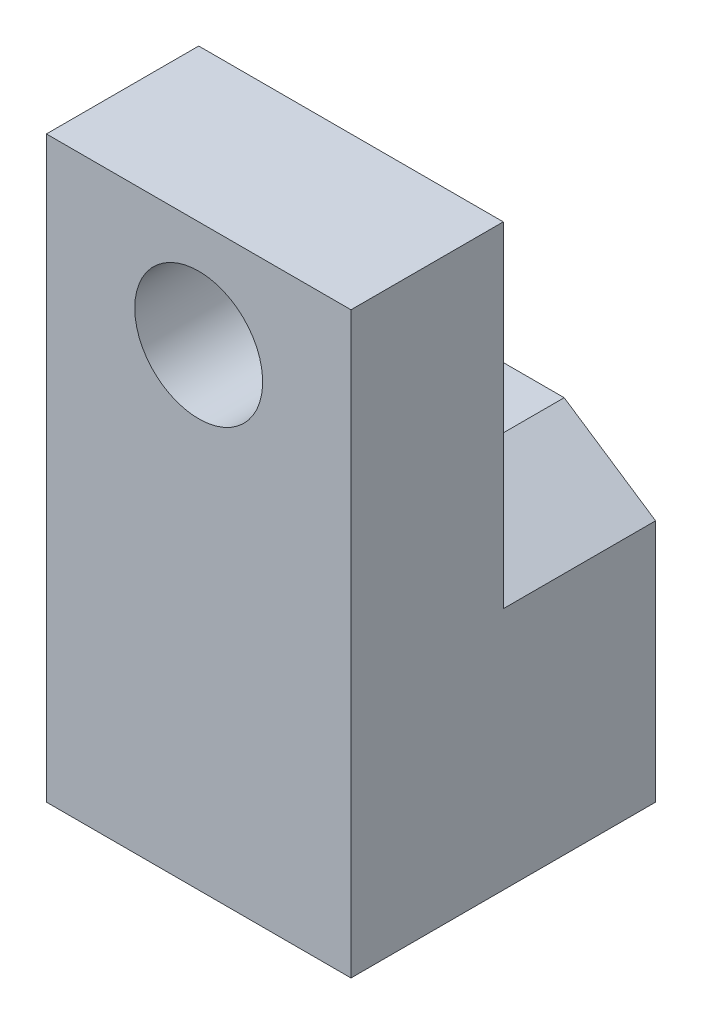
from build123d import *

# Parameters (mm, degrees)
SKETCH_1_W          = 10
SKETCH_1_H          = 19
EXTRUDE_1_DEPTH     = 10
SKETCH_3_R          = 2.1
CUT_EXTRUDE_2_DEPTH = 15.671400751
CUT_EXTRUDE_4_DEPTH = 5
SKETCH_2_R          = 1.5
CUT_EXTRUDE_1_DEPTH = 10


with BuildPart() as part:
    # 草图1 → 凸台-拉伸1 (new body)
    with BuildSketch(Plane.XY):
        Rectangle(SKETCH_1_W, SKETCH_1_H)
    extrude(amount=EXTRUDE_1_DEPTH)

    # 草图3 → 切除-拉伸2 (cut, through all)
    with BuildSketch(Plane(origin=(0, 0, 0), x_dir=(-1, 0, 0), z_dir=(0, 0, -1))):
        with Locations((0, 6)):
            Circle(SKETCH_3_R)
    extrude(amount=-CUT_EXTRUDE_2_DEPTH, mode=Mode.SUBTRACT)

    # 草图6 → 切除-拉伸4 (cut)
    with BuildSketch(Plane(origin=(0, 0, 0), x_dir=(-1, 0, 0), z_dir=(0, 0, -1))):
        Polygon((5, 9.5), (-5, 9.5), (-5, -1.5), (-2, 0.5), (2, 0.5), (5, -1.5), align=None)
    extrude(amount=-CUT_EXTRUDE_4_DEPTH, mode=Mode.SUBTRACT)

    # 草图2 → 切除-拉伸1 (cut)
    with BuildSketch(Plane.XZ.offset(9.5)):
        with Locations(Location((0, 5, 0), (0, 0, 270))):
            Circle(SKETCH_2_R)
    extrude(amount=-CUT_EXTRUDE_1_DEPTH, mode=Mode.SUBTRACT)


solid = part.part
